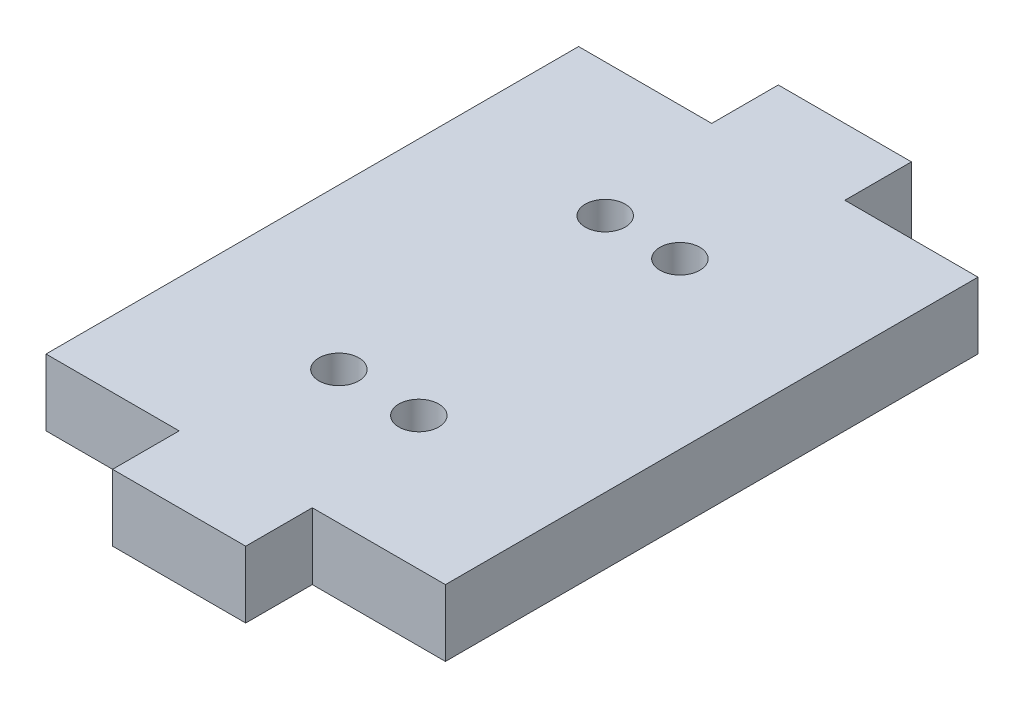
from build123d import *

# Parameters (mm, degrees)
SKETCH_1_R      = 1.5
EXTRUDE_1_DEPTH = 5


with BuildPart() as part:
    # 草图1 → 凸台-拉伸1 (new body)
    with BuildSketch(Plane(origin=(0, 0, 0), x_dir=(1, 0, 0), z_dir=(0, 1, 0))):
        Polygon((20, 40), (30, 40), (30, 0), (20, 0), (20, -5), (10, -5), (10, 0), (0, 0), (0, 40), (10, 40), (10, 45), (20, 45), align=None)
        with Locations(Location((12, 30, 0), (0, 0, 270))):
            Circle(SKETCH_1_R, mode=Mode.SUBTRACT)
        with Locations(Location((17.61050347, 30, 0), (0, 0, 270))):
            Circle(SKETCH_1_R, mode=Mode.SUBTRACT)
        with Locations(Location((18, 10, 0), (0, 0, 270))):
            Circle(SKETCH_1_R, mode=Mode.SUBTRACT)
        with Locations(Location((12, 10, 0), (0, 0, 270))):
            Circle(SKETCH_1_R, mode=Mode.SUBTRACT)
    extrude(amount=EXTRUDE_1_DEPTH)


solid = part.part
